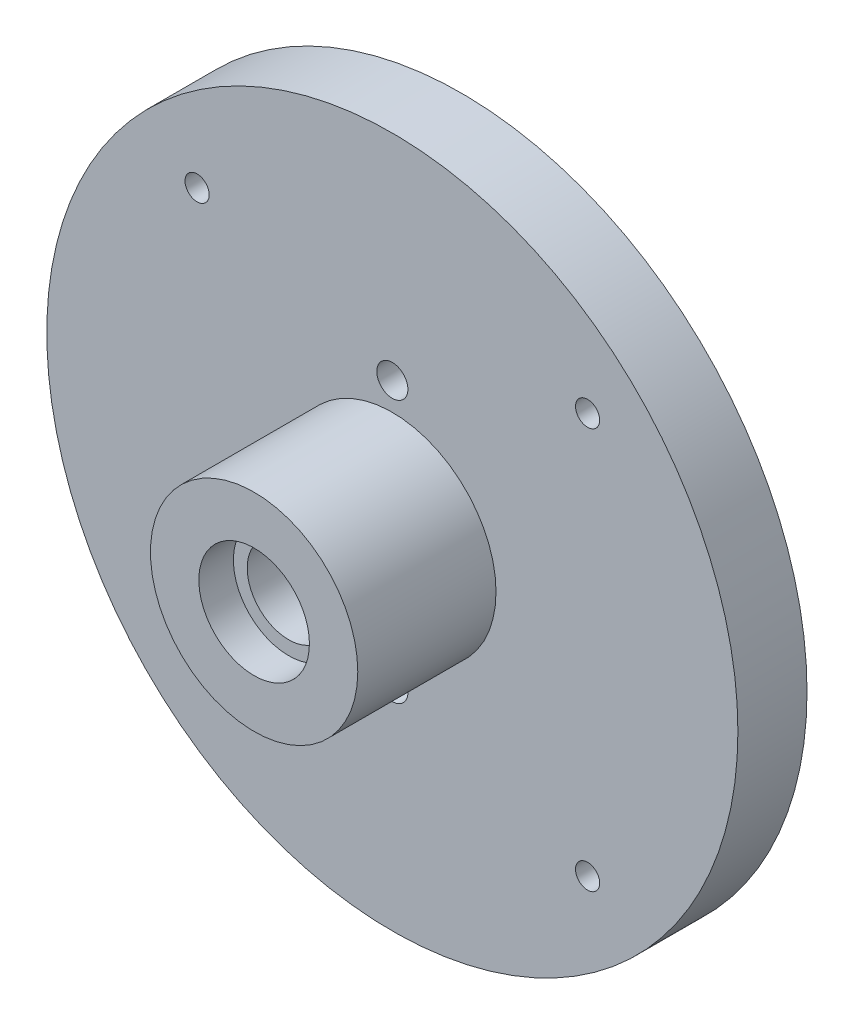
from build123d import *

# Parameters (mm, degrees)
SKETCH1_R           = 50
BOSS_EXTRUDE1_DEPTH = 10
SKETCH2_R           = 15
BOSS_EXTRUDE2_DEPTH = 20
SKETCH5_R           = 8
CUT_EXTRUDE2_DEPTH  = 5
SKETCH6_R           = 6
CUT_EXTRUDE3_DEPTH  = 76
SKETCH7_R           = 1.75
CUT_EXTRUDE4_DEPTH  = 77.811457479
SKETCH8_R           = 2.25
CUT_EXTRUDE5_DEPTH  = 77.811457479


with BuildPart() as part:
    # Sketch1 → Boss-Extrude1 (new body)
    with BuildSketch(Plane.XY):
        Circle(SKETCH1_R)
    extrude(amount=BOSS_EXTRUDE1_DEPTH)

    # Sketch2 → Boss-Extrude2 (add)
    with BuildSketch(Plane.XY.offset(10)):
        Circle(SKETCH2_R)
    extrude(amount=BOSS_EXTRUDE2_DEPTH)

    # Sketch5 → Cut-Extrude2 (cut)
    with BuildSketch(Plane.XY.offset(30)):
        Circle(SKETCH5_R)
    extrude(amount=-CUT_EXTRUDE2_DEPTH, mode=Mode.SUBTRACT)

    # Sketch6 → Cut-Extrude3 (cut, through all)
    with BuildSketch(Plane.XY.offset(25)):
        Circle(SKETCH6_R)
    extrude(amount=-CUT_EXTRUDE3_DEPTH, mode=Mode.SUBTRACT)

    # Sketch7 → Cut-Extrude4 (cut, through all)
    with BuildSketch(Plane(origin=(0, 0, 0), x_dir=(-1, 0, 0), z_dir=(0, 0, -1))):
        with Locations((-28.25, 29)):
            Circle(SKETCH7_R)
        with Locations(Location((28.25, 29, 0), (0, 0, 180))):
            Circle(SKETCH7_R)
        with Locations((28.25, -29)):
            Circle(SKETCH7_R)
        with Locations(Location((-28.25, -29, 0), (0, 0, 180))):
            Circle(SKETCH7_R)
    extrude(amount=-CUT_EXTRUDE4_DEPTH, mode=Mode.SUBTRACT)

    # Sketch8 → Cut-Extrude5 (cut, through all)
    with BuildSketch(Plane(origin=(0, 0, 0), x_dir=(-1, 0, 0), z_dir=(0, 0, -1))):
        with Locations((0, 19)):
            Circle(SKETCH8_R)
        with Locations(Location((0, -19, 0), (0, 0, 180))):
            Circle(SKETCH8_R)
    extrude(amount=-CUT_EXTRUDE5_DEPTH, mode=Mode.SUBTRACT)


solid = part.part
